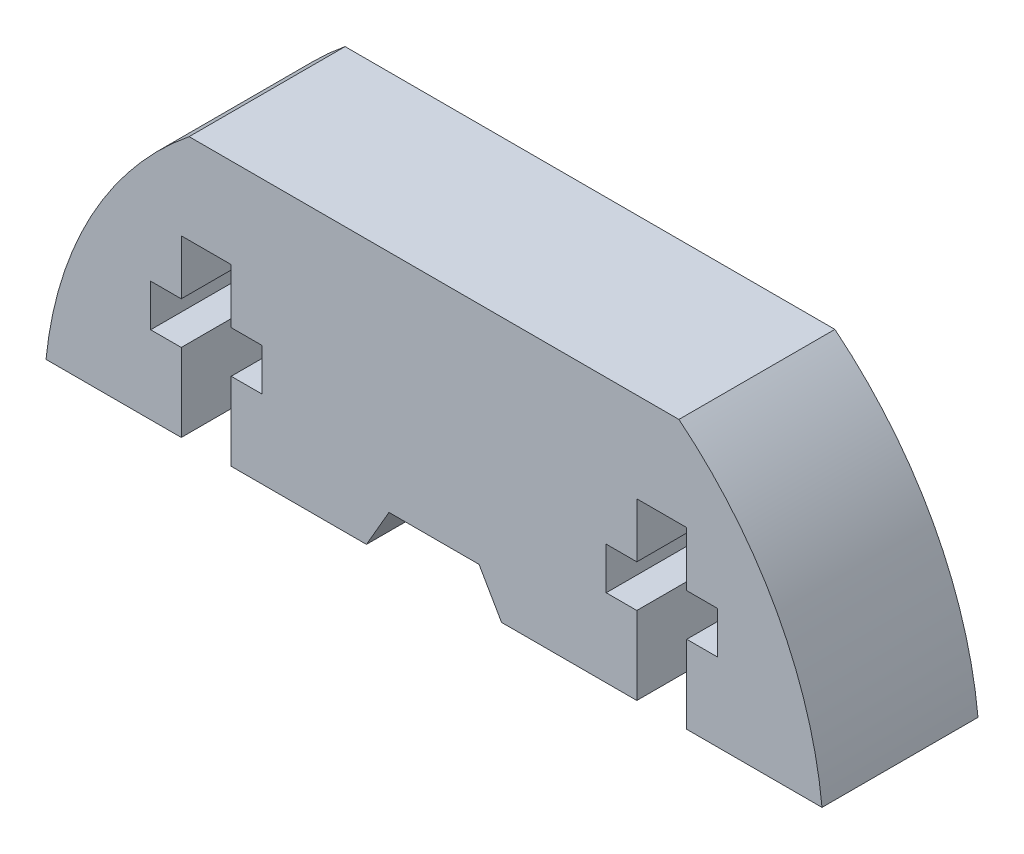
from build123d import *

# Parameters (mm, degrees)
BOSS_EXTRUDE2_DEPTH = 10


with BuildPart() as part:
    # Sketch2 → Boss-Extrude2 (new body)
    with BuildSketch(Plane.XY):
        with BuildLine():
            Line((0, 19.454800467), (0, 5))
            Line((0, 5), (2.886751346, 5))
            Line((2.886751346, 5), (4.330127019, 2.5))
            Line((4.330127019, 2.5), (13.002406473, 2.5))
            Line((13.002406473, 2.5), (13.002406473, 7.5))
            Line((13.002406473, 7.5), (11.039564591, 7.5))
            Line((11.039564591, 7.5), (11.039564591, 10.2))
            Line((11.039564591, 10.2), (13.002406473, 10.2))
            Line((13.002406473, 10.2), (13.002406473, 13.7))
            Line((13.002406473, 13.7), (16.202406473, 13.7))
            Line((16.202406473, 13.7), (16.202406473, 10.2))
            Line((16.202406473, 10.2), (18.165248356, 10.2))
            Line((18.165248356, 10.2), (18.165248356, 7.5))
            Line((18.165248356, 7.5), (16.202406473, 7.5))
            Line((16.202406473, 7.5), (16.202406473, 2.5))
            Line((16.202406473, 2.5), (24.874685928, 2.5))
            ThreePointArc((24.874685928, 2.5), (21.987632849, 11.89722664), (15.700660457, 19.454800467))
            Line((15.700660457, 19.454800467), (0, 19.454800467))
        make_face()
        with BuildLine():
            Line((-13.002406473, 2.5), (-4.330127019, 2.5))
            Line((-4.330127019, 2.5), (-2.886751346, 5))
            Line((-2.886751346, 5), (0, 5))
            Line((0, 5), (0, 19.454800467))
            Line((0, 19.454800467), (-15.700660457, 19.454800467))
            ThreePointArc((-15.700660457, 19.454800467), (-21.987632849, 11.89722664), (-24.874685928, 2.5))
            Line((-24.874685928, 2.5), (-16.202406473, 2.5))
            Line((-16.202406473, 2.5), (-16.202406473, 7.5))
            Line((-16.202406473, 7.5), (-18.165248356, 7.5))
            Line((-18.165248356, 7.5), (-18.165248356, 10.2))
            Line((-18.165248356, 10.2), (-16.202406473, 10.2))
            Line((-16.202406473, 10.2), (-16.202406473, 13.7))
            Line((-16.202406473, 13.7), (-13.002406473, 13.7))
            Line((-13.002406473, 13.7), (-13.002406473, 10.2))
            Line((-13.002406473, 10.2), (-11.039564591, 10.2))
            Line((-11.039564591, 10.2), (-11.039564591, 7.5))
            Line((-11.039564591, 7.5), (-13.002406473, 7.5))
            Line((-13.002406473, 7.5), (-13.002406473, 2.5))
        make_face()
    extrude(amount=BOSS_EXTRUDE2_DEPTH)


solid = part.part
